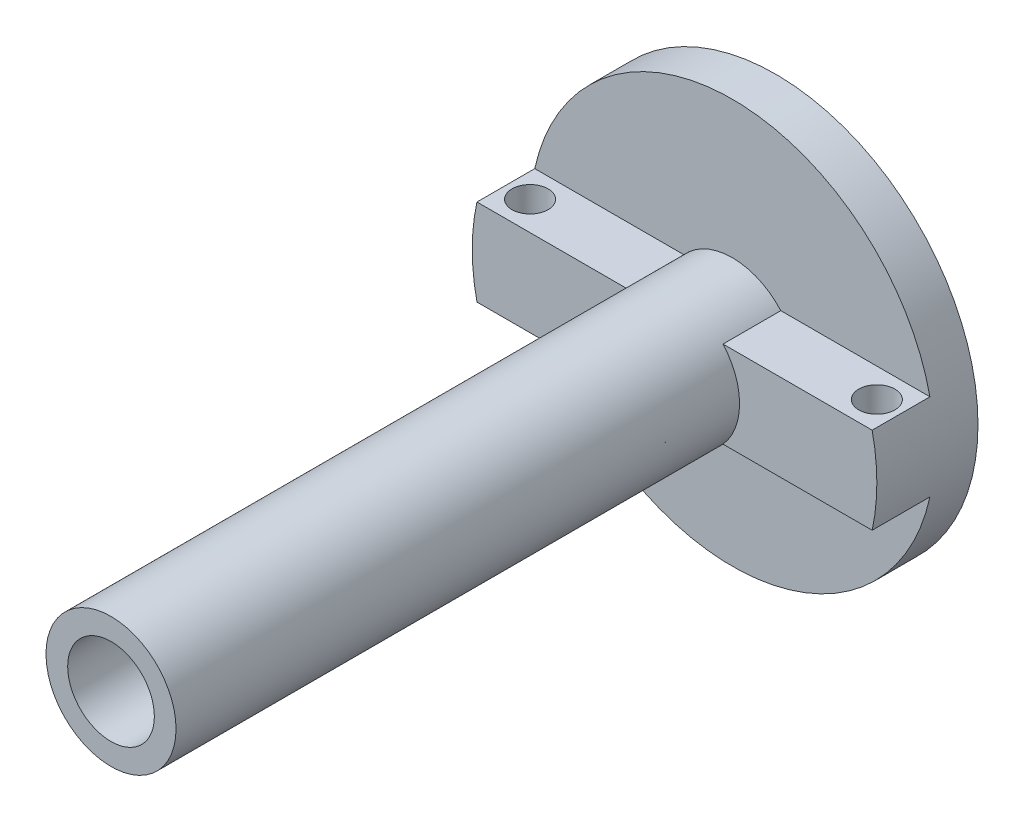
from build123d import *
from build123d.topology import SkipClean

# Parameters (mm, degrees)
SKETCH1_R           = 7
BOSS_EXTRUDE1_DEPTH = 1.5
SKETCH2_R           = 2.25
BOSS_EXTRUDE2_DEPTH = 21.5
CUT_EXTRUDE1_REACH  = 27.04
SKETCH4_R           = 1.5
BOSS_EXTRUDE5_DEPTH = 2
CUT_EXTRUDE5_REACH  = 27.5
SKETCH16_R          = 0.625
CUT_EXTRUDE6_REACH  = 25.67
SKETCH17_R          = 1.5


with BuildPart() as part:
    # Sketch1 → Boss-Extrude1 (new body)
    with BuildSketch(Plane.XY):
        Circle(SKETCH1_R)
    extrude(amount=BOSS_EXTRUDE1_DEPTH)

    # Sketch2 → Boss-Extrude2 (add)
    with BuildSketch(Plane.XY.offset(1.5)):
        Circle(SKETCH2_R)
    extrude(amount=BOSS_EXTRUDE2_DEPTH)

    # Sketch4 → Cut-Extrude1 (cut, up to next)
    with BuildSketch(Plane(origin=(0, 0, 0), x_dir=(-1, 0, 0), z_dir=(0, 0, -1)), mode=Mode.PRIVATE) as cut_extrude1_sk1:
        Circle(SKETCH4_R)
    cut_extrude1_tool1 = extrude(cut_extrude1_sk1.sketch, amount=-CUT_EXTRUDE1_REACH, mode=Mode.PRIVATE) & part.part
    add(cut_extrude1_tool1.solids().sort_by_distance((0, 0, 0))[0], mode=Mode.SUBTRACT)

    # Sketch15 → Boss-Extrude5 (add)
    with SkipClean():  # the faces are left unmerged after this step: merging them gives an invalid solid
        with BuildSketch(Plane.XY.offset(1.5)):
            with BuildLine():
                Line((6.837397, -1.5), (-6.837397, -1.5))
                ThreePointArc((-6.837397, -1.5), (-7, 0), (-6.837397, 1.5))
                Line((-6.837397, 1.5), (6.837397, 1.5))
                ThreePointArc((6.837397, 1.5), (7, 0), (6.837397, -1.5))
            make_face()
        extrude(amount=BOSS_EXTRUDE5_DEPTH)

    # Sketch16 → Cut-Extrude5 (cut, up to next)
    with BuildSketch(Plane.XZ.offset(1.5), mode=Mode.PRIVATE) as cut_extrude5_sk1:
        with Locations((-6, 2.5)):
            Circle(SKETCH16_R)
    cut_extrude5_tool1 = extrude(cut_extrude5_sk1.sketch, amount=-CUT_EXTRUDE5_REACH, mode=Mode.PRIVATE) & part.part
    # Sketch16 → Cut-Extrude5 (cut, up to next)
    with BuildSketch(Plane.XZ.offset(1.5), mode=Mode.PRIVATE) as cut_extrude5_sk2:
        with Locations(Location((6, 2.5, 0), (0, 0, 270))):
            Circle(SKETCH16_R)
    cut_extrude5_tool2 = extrude(cut_extrude5_sk2.sketch, amount=-CUT_EXTRUDE5_REACH, mode=Mode.PRIVATE) & part.part
    add(cut_extrude5_tool1.solids().sort_by_distance((-6, -1.5, 2.5))[0], mode=Mode.SUBTRACT)
    add(cut_extrude5_tool2.solids().sort_by_distance((6, -1.5, 2.5))[0], mode=Mode.SUBTRACT)

    # Sketch17 → Cut-Extrude6 (cut, up to next)
    with BuildSketch(Plane(origin=(0, 0, 1.5), x_dir=(-1, 0, 0), z_dir=(0, 0, -1)), mode=Mode.PRIVATE) as cut_extrude6_sk1:
        Circle(SKETCH17_R)
    cut_extrude6_tool1 = extrude(cut_extrude6_sk1.sketch, amount=-CUT_EXTRUDE6_REACH, mode=Mode.PRIVATE) & part.part
    add(cut_extrude6_tool1.solids().sort_by_distance((0, 0, 1.5))[0], mode=Mode.SUBTRACT)


solid = part.part
